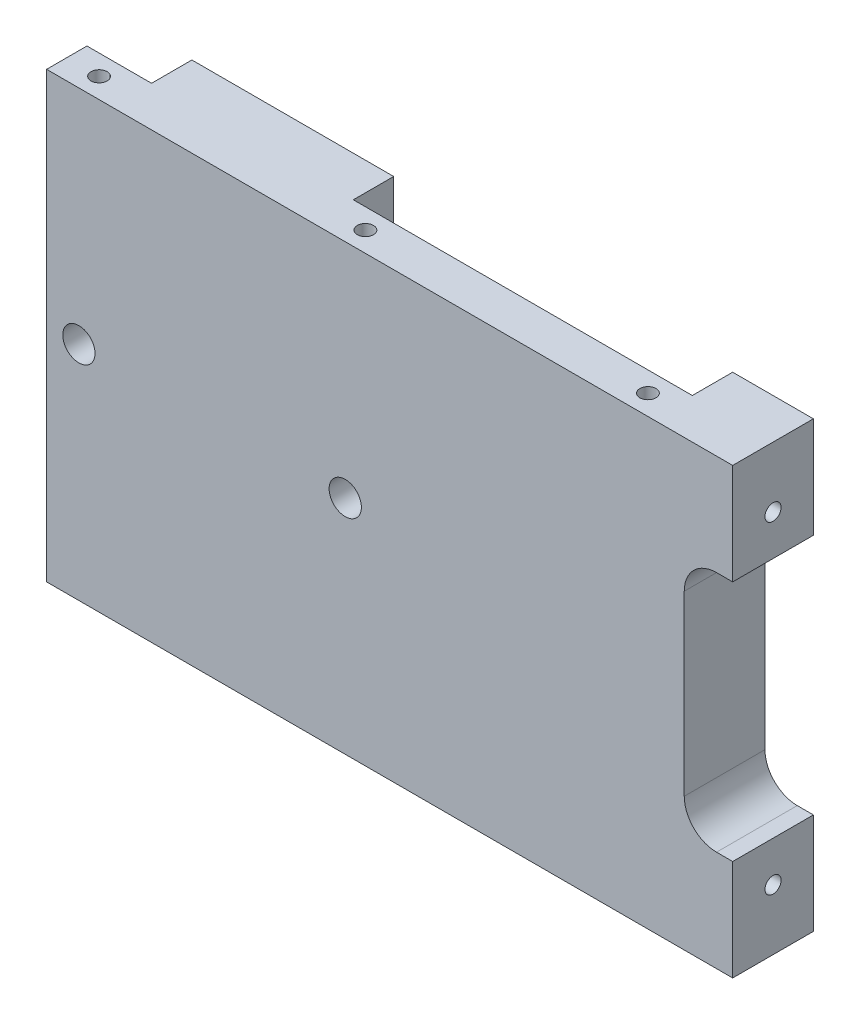
from build123d import *

# Parameters (mm, degrees)
ESQUISSE1_W                    = 85
ESQUISSE1_H                    = 55
BOSS_EXTRU_1_DEPTH             = 10
ESQUISSE2_W                    = 8
ESQUISSE2_H                    = 5
ESQUISSE2_W_2                  = 42
ENL_V_MAT_EXTRU_1_DEPTH        = 102.734949747
ESQUISSE3_R                    = 2
ENL_V_MAT_EXTRU_2_DEPTH        = 90.895772982
TROU_TARAUD_M3X0_51_AT_2_COUNT = 2
TROU_TARAUD_M3X0_51_AT_2_PITCH = 33
TROU_TARAUD_M3X0_51_AT_3_COUNT = 2
TROU_TARAUD_M3X0_51_AT_3_PITCH = 68
TROU_TARAUD_M3X0_52_D          = 2
TROU_TARAUD_M3X0_52_DEPTH      = 12
TROU_TARAUD_M3X0_52_TIP        = 0.600860619
ESQUISSE9_W                    = 6
ESQUISSE9_H                    = 30
ENL_V_MAT_EXTRU_4_DEPTH        = 90.895772982
CONG_1_R                       = 4


with BuildPart() as part:
    # Esquisse1 → Boss.-Extru.1 (new body)
    with BuildSketch(Plane.XY):
        with Locations((42.5, 0)):
            Rectangle(ESQUISSE1_W, ESQUISSE1_H)
    extrude(amount=BOSS_EXTRU_1_DEPTH)

    # Esquisse2 → Enlèv. mat.-Extru.1 (cut, through all)
    with BuildSketch(Plane(origin=(0, 27.5, 0), x_dir=(1, 0, 0), z_dir=(0, 1, 0))):
        with Locations((4, -2.5)):
            Rectangle(ESQUISSE2_W, ESQUISSE2_H)
        with Locations((54, -2.5)):
            Rectangle(ESQUISSE2_W_2, ESQUISSE2_H)
    extrude(amount=-ENL_V_MAT_EXTRU_1_DEPTH, mode=Mode.SUBTRACT)

    # Esquisse3 → Enlèv. mat.-Extru.2 (cut, through all)
    with BuildSketch(Plane.XY.offset(10)):
        with Locations((4, 0)):
            Circle(ESQUISSE3_R)
        with Locations((37, 0)):
            Circle(ESQUISSE3_R)
    extrude(amount=-ENL_V_MAT_EXTRU_2_DEPTH, mode=Mode.SUBTRACT)

    # Esquisse4 → Trou taraudé M3x0.51 (revolve, cut)
    with BuildSketch(Plane(origin=(4, -27.5, 7.5), x_dir=(0, 0, -1), z_dir=(1, 0, 0))):
        Polygon((0, 0), (0, 15.600860619), (1, 15), (1, 0), align=None)
    trou_taraud_m3x0_51 = revolve(axis=Axis((4, -33.85, 7.5), (0, 1, 0)), mode=Mode.SUBTRACT)

    # Trou taraudé M3x0.51 at 2: Trou taraudé M3x0.51 ×2
    with Locations(*[(i * TROU_TARAUD_M3X0_51_AT_2_PITCH, 0, 0) for i in range(1, TROU_TARAUD_M3X0_51_AT_2_COUNT)]):
        add(trou_taraud_m3x0_51, mode=Mode.SUBTRACT)

    # Trou taraudé M3x0.51 at 3: Trou taraudé M3x0.51 ×2
    with Locations(*[(i * TROU_TARAUD_M3X0_51_AT_3_PITCH, 0, 0) for i in range(1, TROU_TARAUD_M3X0_51_AT_3_COUNT)]):
        add(trou_taraud_m3x0_51, mode=Mode.SUBTRACT)

    # Symétrie1: Trou taraudé M3x0.51 across plane
    add(trou_taraud_m3x0_51.mirror(Plane.ZX), mode=Mode.SUBTRACT)

    # Symétrie1 copy 1 sketch → Symétrie1 copy 1 (revolve, cut)
    with BuildSketch(Plane(origin=(37, 27.5, 7.5), x_dir=(0, 0, -1), z_dir=(1, 0, 0))):
        Polygon((0, 0), (0, -15.600860619), (1, -15), (1, 0), align=None)
    revolve(axis=Axis((37, 33.85, 7.5), (0, 1, 0)), mode=Mode.SUBTRACT)

    # Symétrie1 copy 2 sketch → Symétrie1 copy 2 (revolve, cut)
    with BuildSketch(Plane(origin=(72, 27.5, 7.5), x_dir=(0, 0, -1), z_dir=(1, 0, 0))):
        Polygon((0, 0), (0, -15.600860619), (1, -15), (1, 0), align=None)
    revolve(axis=Axis((72, 33.85, 7.5), (0, 1, 0)), mode=Mode.SUBTRACT)

    # Trou taraudé M3x0.52
    with Locations(Plane(origin=(85, 0, 0), x_dir=(0, 0, -1), z_dir=(1, 0, 0))):
        with Locations((-5, 20), (-5, -20)):
            Hole(TROU_TARAUD_M3X0_52_D / 2, depth=TROU_TARAUD_M3X0_52_DEPTH)
            with Locations((0, 0, -(TROU_TARAUD_M3X0_52_DEPTH + TROU_TARAUD_M3X0_52_TIP / 2))):  # 118° drill point
                Cone(0, TROU_TARAUD_M3X0_52_D / 2, TROU_TARAUD_M3X0_52_TIP, mode=Mode.SUBTRACT)

    # Esquisse9 → Enlèv. mat.-Extru.4 (cut, through all)
    with BuildSketch(Plane.XY.offset(10)):
        with Locations((82, 0)):
            Rectangle(ESQUISSE9_W, ESQUISSE9_H)
    extrude(amount=-ENL_V_MAT_EXTRU_4_DEPTH, mode=Mode.SUBTRACT)

    # Congé1
    cong_1_edges = [part.edges().sort_by_distance(p)[0] for p in [
        (79, -15, 5),
        (79, 15, 5),
    ]]
    fillet(cong_1_edges, radius=CONG_1_R)


solid = part.part
